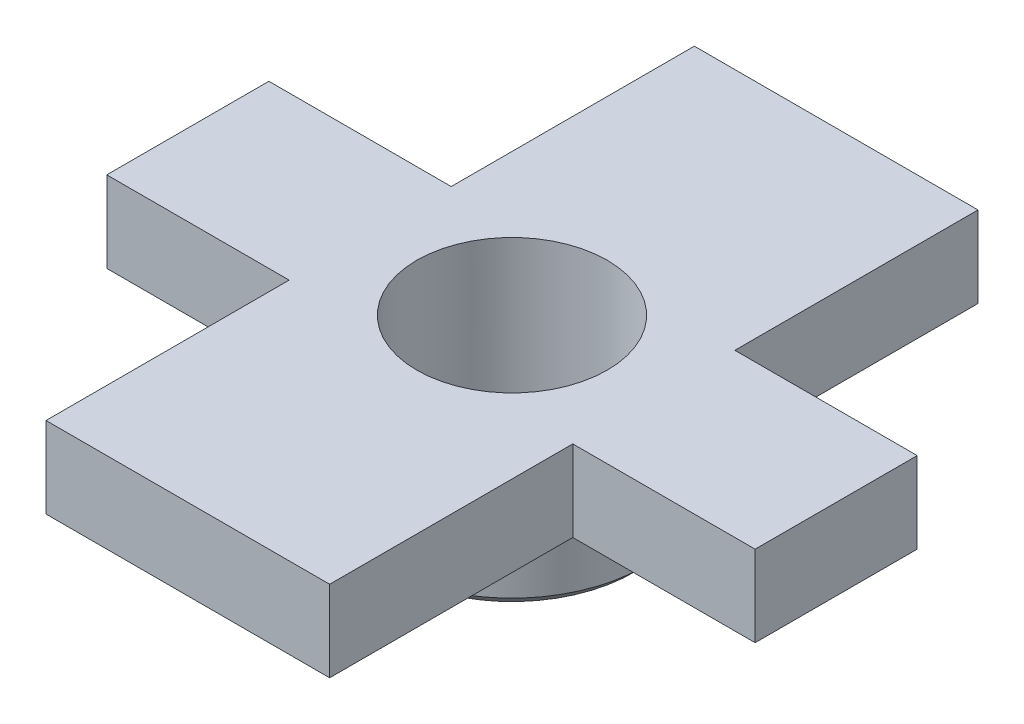
from build123d import *

# Parameters (mm, degrees)
GRUNDPLATTE_KREUZ_DEPTH         = 2
MITTELBOHRUNG_DEPTH             = 12.489125293
MITTELBOHRUNG_DEPTH_BACK        = 12.489125293
SKIZZE11_R                      = 1.25
SKIZZE12_R                      = 3.25
AUFSATZ_LINEAR_AUSTRAGEN2_DEPTH = 2
FASE1_SIZE                      = 0.25
SKIZZE13_R                      = 2.35
SCHNITT_LINEAR_AUSTRAGEN1_DEPTH = 4


with BuildPart() as part:
    # Skizze4 → Grundplatte Kreuz (new body)
    with BuildSketch(Plane(origin=(0, 0, 0), x_dir=(1, 0, 0), z_dir=(0, 1, 0))):
        Polygon((-8, -2), (-8, 2), (-3.5, 2), (-3.5, 8), (3.5, 8), (3.5, 2), (8, 2), (8, -2), (3.5, -2), (3.5, -8), (-3.5, -8), (-3.5, -2), align=None)
    extrude(amount=GRUNDPLATTE_KREUZ_DEPTH)

    # Skizze11 → Mittelbohrung (cut, two sides: drawn at the far end of the back side and taken through both)
    with BuildSketch(Plane(origin=(0, 0, 0), x_dir=(1, 0, 0), z_dir=(0, 1, 0)).offset(-MITTELBOHRUNG_DEPTH_BACK)):
        with Locations(Location((0, 0, 0), (0, 0, 270))):
            Circle(SKIZZE11_R)
    extrude(amount=MITTELBOHRUNG_DEPTH + MITTELBOHRUNG_DEPTH_BACK, mode=Mode.SUBTRACT)

    # Skizze12 → Aufsatz-Linear austragen2 (add)
    with BuildSketch(Plane.XZ):
        with Locations(Location((0, 0, 0), (0, 0, 90))):
            Circle(SKIZZE12_R)
    extrude(amount=AUFSATZ_LINEAR_AUSTRAGEN2_DEPTH)

    # Fase1
    fase1_edges = [part.edges().sort_by_distance(p)[0] for p in [
        (0, -2, -3.25),
    ]]
    chamfer(fase1_edges, length=FASE1_SIZE)

    # Skizze13 → Schnitt-Linear austragen1 (cut)
    with BuildSketch(Plane.XZ.offset(2)):
        with Locations(Location((0, 0, 0), (0, 0, 270))):
            Circle(SKIZZE13_R)
    extrude(amount=-SCHNITT_LINEAR_AUSTRAGEN1_DEPTH, mode=Mode.SUBTRACT)


solid = part.part
